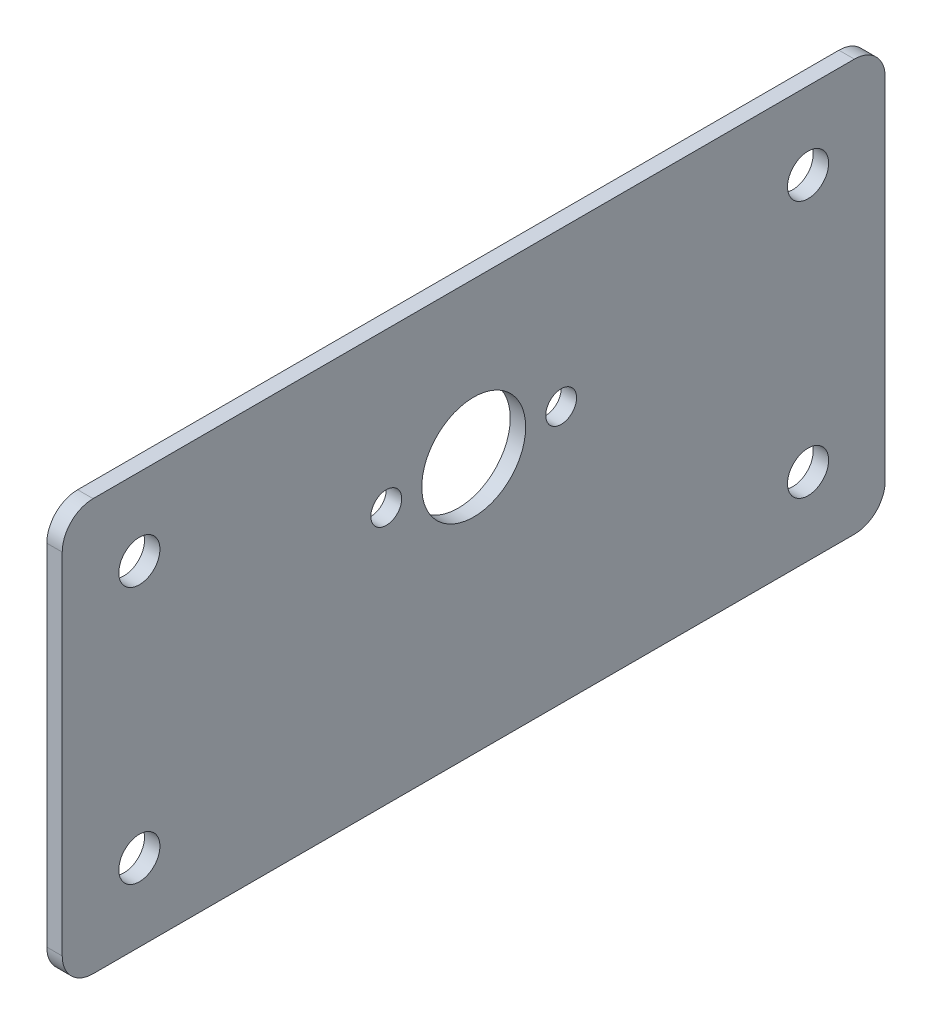
from build123d import *

# Parameters (mm, degrees)
SKETCH_1_W      = 80
SKETCH_1_H      = 40
SKETCH_1_R      = 2
SKETCH_1_R_2    = 5.05
SKETCH_1_R_3    = 1.5
EXTRUDE_1_DEPTH = 1.5
FILLET_1_R      = 3


with BuildPart() as part:
    # ｽｹｯﾁ1 → ﾎﾞｽ - 押し出し1 (new body)
    with BuildSketch(Plane(origin=(0, 0, 0), x_dir=(0, 0, -1), z_dir=(1, 0, 0))):
        Rectangle(SKETCH_1_W, SKETCH_1_H)
        with Locations((32.5, 12.5)):
            Circle(SKETCH_1_R, mode=Mode.SUBTRACT)
        with Locations(Location((-32.5, 12.5, 0), (0, 0, 180))):
            Circle(SKETCH_1_R, mode=Mode.SUBTRACT)
        with Locations((32.5, -12.5)):
            Circle(SKETCH_1_R, mode=Mode.SUBTRACT)
        with Locations((0, 5)):
            Circle(SKETCH_1_R_2, mode=Mode.SUBTRACT)
        with Locations(Location((-32.5, -12.5, 0), (0, 0, 180))):
            Circle(SKETCH_1_R, mode=Mode.SUBTRACT)
        with Locations((8.5, 5)):
            Circle(SKETCH_1_R_3, mode=Mode.SUBTRACT)
        with Locations(Location((-8.5, 5, 0), (0, 0, 180))):
            Circle(SKETCH_1_R_3, mode=Mode.SUBTRACT)
    extrude(amount=EXTRUDE_1_DEPTH)

    # ﾌｨﾚｯﾄ1
    fillet_1_edges = [part.edges().sort_by_distance(p)[0] for p in [
        (0.75, -20, -40),
        (0.75, -20, 40),
        (0.75, 20, 40),
        (0.75, 20, -40),
    ]]
    fillet(fillet_1_edges, radius=FILLET_1_R)


solid = part.part
